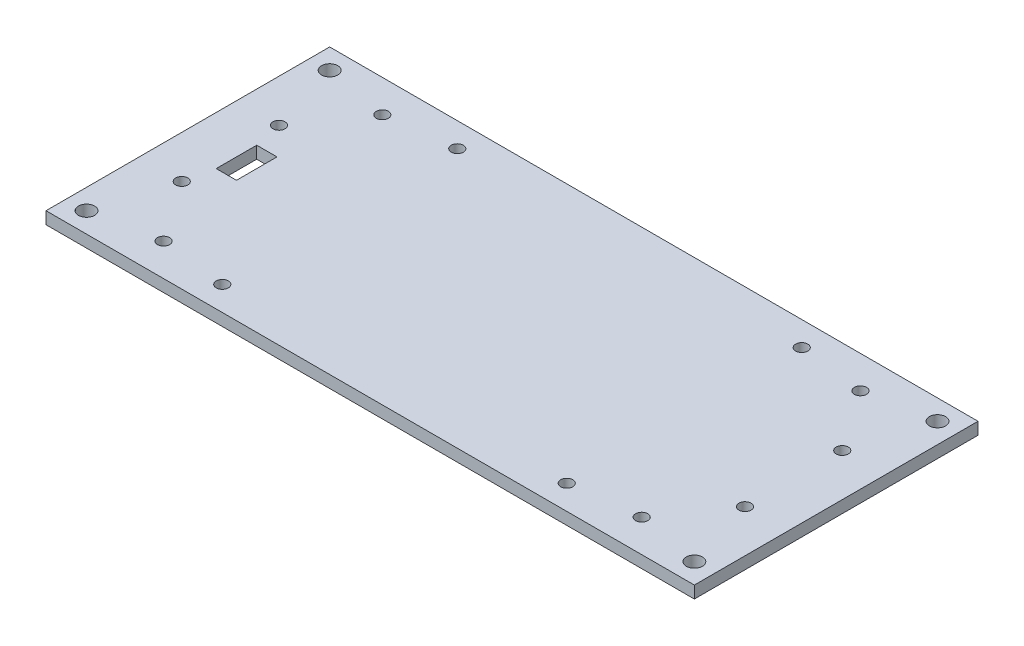
from build123d import *

# Parameters (mm, degrees)
SKETCH1_W      = 160
SKETCH1_H      = 70
EXTRUDE1_DEPTH = 3
SKETCH2_R      = 2
EXTRUDE2_DEPTH = 120
SKETCH3_R      = 1.5
EXTRUDE3_DEPTH = 10
SKETCH4_R      = 1.5
EXTRUDE4_DEPTH = 10
SKETCH5_R      = 1.5
EXTRUDE5_DEPTH = 10
SKETCH6_W      = 5
SKETCH6_H      = 10
EXTRUDE6_DEPTH = 5


with BuildPart() as part:
    # Sketch1 → Extrude1 (new body)
    with BuildSketch(Plane(origin=(0, 0, 0), x_dir=(1, 0, 0), z_dir=(0, 1, 0))):
        Rectangle(SKETCH1_W, SKETCH1_H)
    extrude(amount=EXTRUDE1_DEPTH)

    # Sketch2 → Extrude2 (cut)
    with BuildSketch(Plane(origin=(0, 3, 0), x_dir=(1, 0, 0), z_dir=(0, 1, 0))):
        with Locations(Location((-75, 30, 0), (0, 0, 270))):
            Circle(SKETCH2_R)
        with Locations(Location((-75, -30, 0), (0, 0, 270))):
            Circle(SKETCH2_R)
        with Locations(Location((75, -30, 0), (0, 0, 270))):
            Circle(SKETCH2_R)
        with Locations(Location((75, 30, 0), (0, 0, 270))):
            Circle(SKETCH2_R)
    extrude(amount=-EXTRUDE2_DEPTH, mode=Mode.SUBTRACT)

    # Sketch3 → Extrude3 (cut)
    with BuildSketch(Plane(origin=(0, 3, 0), x_dir=(1, 0, 0), z_dir=(0, 1, 0))):
        with Locations(Location((-59, 27, 0), (0, 0, 270))):
            Circle(SKETCH3_R)
        with Locations(Location((-59, -27, 0), (0, 0, 270))):
            Circle(SKETCH3_R)
        with Locations(Location((59, -27, 0), (0, 0, 270))):
            Circle(SKETCH3_R)
        with Locations(Location((59, 27, 0), (0, 0, 270))):
            Circle(SKETCH3_R)
    extrude(amount=-EXTRUDE3_DEPTH, mode=Mode.SUBTRACT)

    # Sketch4 → Extrude4 (cut)
    with BuildSketch(Plane(origin=(0, 3, 0), x_dir=(1, 0, 0), z_dir=(0, 1, 0))):
        with Locations(Location((-69.5, 12, 0), (0, 0, 270))):
            Circle(SKETCH4_R)
        with Locations(Location((-69.5, -12, 0), (0, 0, 270))):
            Circle(SKETCH4_R)
        with Locations(Location((69.5, -12, 0), (0, 0, 270))):
            Circle(SKETCH4_R)
        with Locations(Location((69.5, 12, 0), (0, 0, 270))):
            Circle(SKETCH4_R)
    extrude(amount=-EXTRUDE4_DEPTH, mode=Mode.SUBTRACT)

    # Sketch5 → Extrude5 (cut)
    with BuildSketch(Plane(origin=(0, 3, 0), x_dir=(1, 0, 0), z_dir=(0, 1, 0))):
        with Locations(Location((-42.5, 29, 0), (0, 0, 270))):
            Circle(SKETCH5_R)
        with Locations(Location((-42.5, -29, 0), (0, 0, 270))):
            Circle(SKETCH5_R)
        with Locations(Location((42.5, -29, 0), (0, 0, 270))):
            Circle(SKETCH5_R)
        with Locations(Location((42.5, 29, 0), (0, 0, 270))):
            Circle(SKETCH5_R)
    extrude(amount=-EXTRUDE5_DEPTH, mode=Mode.SUBTRACT)

    # Sketch6 → Extrude6 (cut)
    with BuildSketch(Plane.XZ):
        with Locations((-65.5, 0)):
            Rectangle(SKETCH6_W, SKETCH6_H)
    extrude(amount=-EXTRUDE6_DEPTH, mode=Mode.SUBTRACT)


solid = part.part
